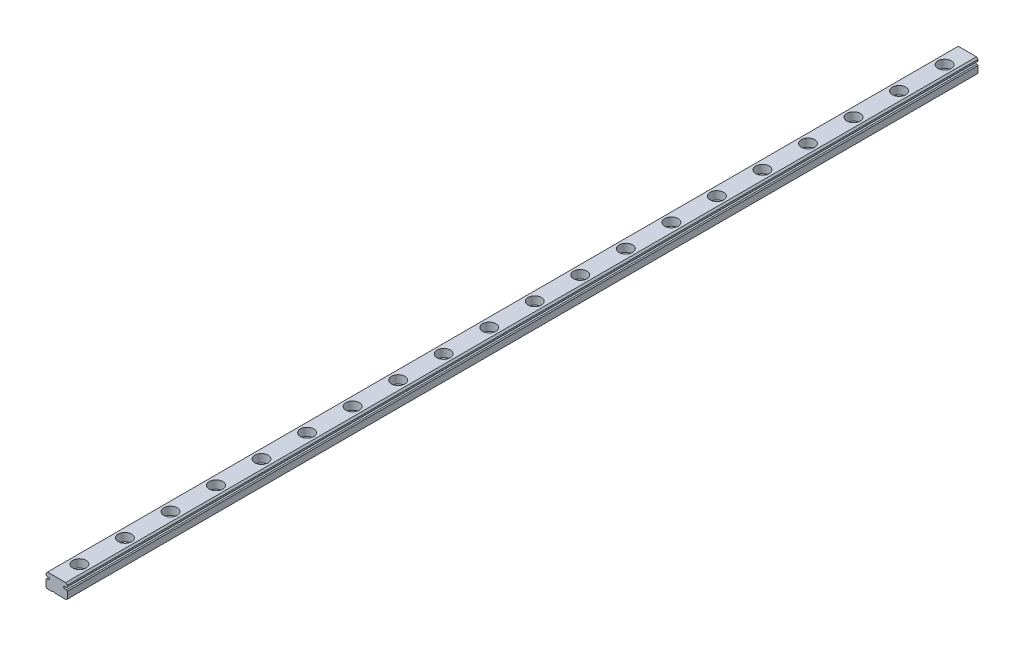
from build123d import *

# Parameters (mm, degrees)
BOSS_EXTRUDE1_DEPTH            = 150
CHAMFER1_SIZE                  = 0.5
CHAMFER2_SIZE                  = 0.3
CBORE_FOR_M2_SHCS1_D           = 2.4
CBORE_FOR_M2_SHCS1_CBORE_D     = 4.4
CBORE_FOR_M2_SHCS1_CBORE_DEPTH = 2.65
LPATTERN1_COUNT                = 20
LPATTERN1_PITCH                = 15


with BuildPart() as part:
    # Sketch3 → Boss-Extrude1 (new, symmetric)
    with BuildSketch(Plane.XY):
        with BuildLine():
            Line((-3.5, 0), (-1.35, 0))
            ThreePointArc((-1.35, 0), (-1, 0.142928579), (-0.65, 0))
            Line((-0.65, 0), (3.5, 0))
            Line((3.5, 0), (3.5, 2.83))
            Line((3.5, 2.83), (2.65, 2.83))
            ThreePointArc((2.65, 2.83), (2.315, 3.165), (2.65, 3.5))
            Line((2.65, 3.5), (3.5, 3.5))
            Line((3.5, 3.5), (3.5, 4.8))
            Line((3.5, 4.8), (-3.5, 4.8))
            Line((-3.5, 4.8), (-3.5, 3.5))
            Line((-3.5, 3.5), (-2.65, 3.5))
            ThreePointArc((-2.65, 3.5), (-2.315, 3.165), (-2.65, 2.83))
            Line((-2.65, 2.83), (-3.5, 2.83))
            Line((-3.5, 2.83), (-3.5, 0))
        make_face()
    extrude(amount=BOSS_EXTRUDE1_DEPTH, both=True)

    # Chamfer1
    chamfer1_edges = [part.edges().sort_by_distance(p)[0] for p in [
        (-3.5, 4.8, 0),
        (3.5, 4.8, 0),
    ]]
    chamfer(chamfer1_edges, length=CHAMFER1_SIZE)

    # Chamfer2
    chamfer2_edges = [part.edges().sort_by_distance(p)[0] for p in [
        (-3.5, 2.83, 0),
        (-3.5, 3.5, 0),
        (3.5, 3.5, 0),
        (3.5, 2.83, 0),
        (3.5, 0, 0),
        (-3.5, 0, 0),
    ]]
    chamfer(chamfer2_edges, length=CHAMFER2_SIZE)

    # CBORE for M2 SHCS1 (through all)
    with Locations(Plane(origin=(0, 4.8, 0), x_dir=(1, 0, 0), z_dir=(0, 1, 0))):
        with Locations((0, -142.5)):
            cbore_for_m2_shcs1 = CounterBoreHole(CBORE_FOR_M2_SHCS1_D / 2, CBORE_FOR_M2_SHCS1_CBORE_D / 2, CBORE_FOR_M2_SHCS1_CBORE_DEPTH)

    # LPattern1: CBORE for M2 SHCS1 ×20
    with Locations(*[(0, 0, -i * LPATTERN1_PITCH) for i in range(1, LPATTERN1_COUNT)]):
        add(cbore_for_m2_shcs1, mode=Mode.SUBTRACT)


solid = part.part
